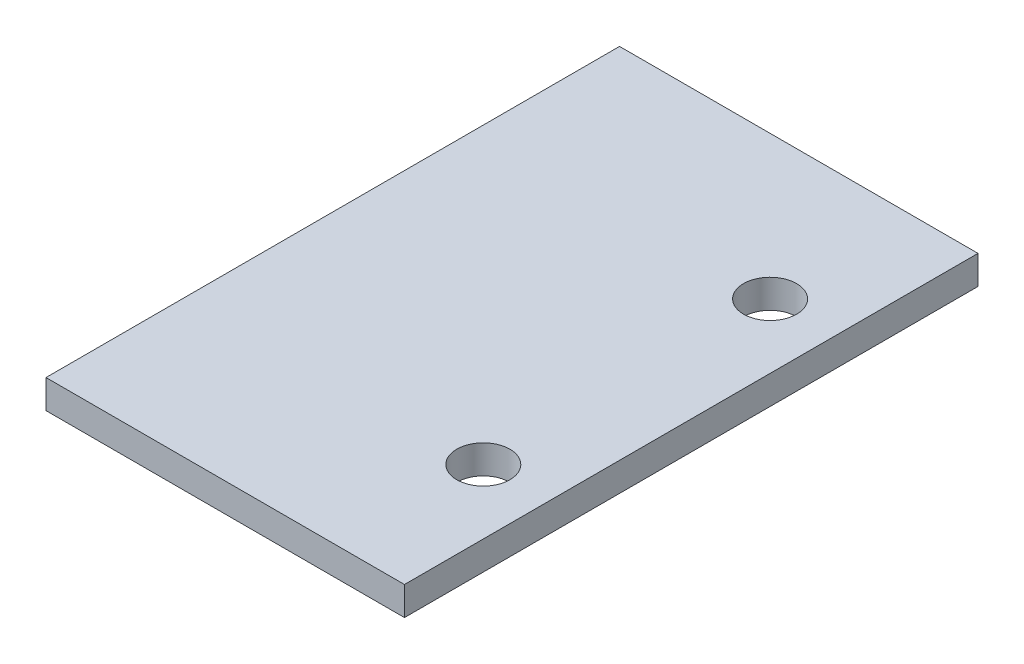
from build123d import *

# Parameters (mm, degrees)
SKETCH1_W           = 25
SKETCH1_H           = 40
SKETCH1_R           = 1.85
BOSS_EXTRUDE1_DEPTH = 2


with BuildPart() as part:
    # Sketch1 → Boss-Extrude1 (new body)
    with BuildSketch(Plane(origin=(0, 0, 0), x_dir=(1, 0, 0), z_dir=(0, 1, 0))):
        with Locations((12.5, 20)):
            Rectangle(SKETCH1_W, SKETCH1_H)
        with Locations(Location((20.5, 30, 0), (0, 0, 270))):
            Circle(SKETCH1_R, mode=Mode.SUBTRACT)
        with Locations(Location((20.5, 10, 0), (0, 0, 270))):
            Circle(SKETCH1_R, mode=Mode.SUBTRACT)
    extrude(amount=BOSS_EXTRUDE1_DEPTH)


solid = part.part
